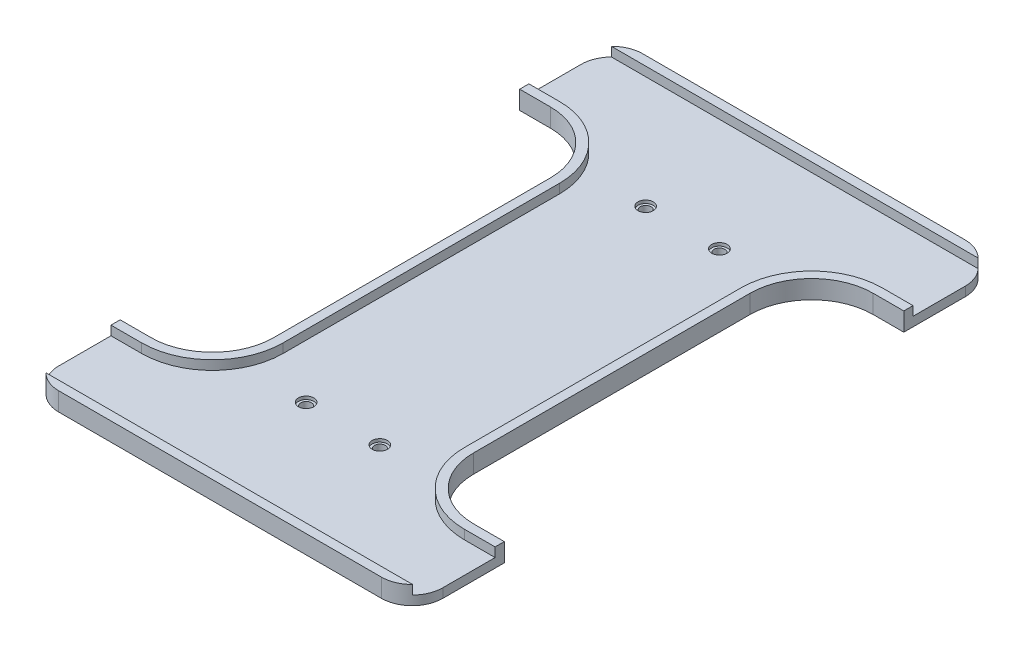
from build123d import *

# Parameters (mm, degrees)
SKETCH1_W           = 125
SKETCH1_H           = 190
SKETCH1_R           = 2.5
SKETCH1_R_2         = 1.75
BOSS_EXTRUDE1_DEPTH = 3
CUT_EXTRUDE1_START  = 2
SKETCH1_3_R         = 2.5
SKETCH1_3_R_2       = 1.75
CUT_EXTRUDE1_DEPTH  = 1
SKETCH2_W           = 30
SKETCH2_H           = 130
CUT_EXTRUDE2_DEPTH  = 114.75521966
FILLET1_R           = 20
FILLET2_R           = 10
BOSS_EXTRUDE2_DEPTH = 3


with BuildPart() as part:
    # Sketch1 → Boss-Extrude1 (new body)
    # profile 1 of 5: a face of its own
    with BuildSketch(Plane(origin=(0, 0, 0), x_dir=(1, 0, 0), z_dir=(0, 1, 0))):
        Rectangle(SKETCH1_W, SKETCH1_H)
        with Locations((-12, 55.5)):
            Circle(SKETCH1_R, mode=Mode.SUBTRACT)
        with Locations((12, 55.5)):
            Circle(SKETCH1_R, mode=Mode.SUBTRACT)
        with Locations((-12, -55)):
            Circle(SKETCH1_R, mode=Mode.SUBTRACT)
        with Locations((12, -55)):
            Circle(SKETCH1_R, mode=Mode.SUBTRACT)
    # profile 2 of 5: a face of its own
    with BuildSketch(Plane(origin=(0, 0, 0), x_dir=(1, 0, 0), z_dir=(0, 1, 0))):
        with Locations((-12, -55)):
            Circle(SKETCH1_R)
        with Locations(Location((-12, -55, 0), (0, 0, 270))):
            Circle(SKETCH1_R_2, mode=Mode.SUBTRACT)
    # profile 3 of 5: a face of its own
    with BuildSketch(Plane(origin=(0, 0, 0), x_dir=(1, 0, 0), z_dir=(0, 1, 0))):
        with Locations((12, -55)):
            Circle(SKETCH1_R)
        with Locations(Location((12, -55, 0), (0, 0, 270))):
            Circle(SKETCH1_R_2, mode=Mode.SUBTRACT)
    # profile 4 of 5: a face of its own
    with BuildSketch(Plane(origin=(0, 0, 0), x_dir=(1, 0, 0), z_dir=(0, 1, 0))):
        with Locations((12, 55.5)):
            Circle(SKETCH1_R)
        with Locations(Location((12, 55.5, 0), (0, 0, 270))):
            Circle(SKETCH1_R_2, mode=Mode.SUBTRACT)
    # profile 5 of 5: a face of its own
    with BuildSketch(Plane(origin=(0, 0, 0), x_dir=(1, 0, 0), z_dir=(0, 1, 0))):
        with Locations((-12, 55.5)):
            Circle(SKETCH1_R)
        with Locations(Location((-12, 55.5, 0), (0, 0, 270))):
            Circle(SKETCH1_R_2, mode=Mode.SUBTRACT)
    extrude(amount=BOSS_EXTRUDE1_DEPTH)

    # Sketch1<3> → Cut-Extrude1 (cut)
    # profile 1 of 4: a face of its own
    with BuildSketch(Plane(origin=(0, 0, 0), x_dir=(1, 0, 0), z_dir=(0, 1, 0)).offset(CUT_EXTRUDE1_START)):
        with Locations(Location((-12, -55, 0), (0, 0, 270))):
            Circle(SKETCH1_3_R)
        with Locations(Location((-12, -55, 0), (0, 0, 270))):
            Circle(SKETCH1_3_R_2, mode=Mode.SUBTRACT)
    # profile 2 of 4: a face of its own
    with BuildSketch(Plane(origin=(0, 0, 0), x_dir=(1, 0, 0), z_dir=(0, 1, 0)).offset(CUT_EXTRUDE1_START)):
        with Locations(Location((12, 55.5, 0), (0, 0, 270))):
            Circle(SKETCH1_3_R)
        with Locations(Location((12, 55.5, 0), (0, 0, 270))):
            Circle(SKETCH1_3_R_2, mode=Mode.SUBTRACT)
    # profile 3 of 4: a face of its own
    with BuildSketch(Plane(origin=(0, 0, 0), x_dir=(1, 0, 0), z_dir=(0, 1, 0)).offset(CUT_EXTRUDE1_START)):
        with Locations(Location((-12, 55.5, 0), (0, 0, 270))):
            Circle(SKETCH1_3_R)
        with Locations(Location((-12, 55.5, 0), (0, 0, 270))):
            Circle(SKETCH1_3_R_2, mode=Mode.SUBTRACT)
    # profile 4 of 4: a face of its own
    with BuildSketch(Plane(origin=(0, 0, 0), x_dir=(1, 0, 0), z_dir=(0, 1, 0)).offset(CUT_EXTRUDE1_START)):
        with Locations(Location((12, -55, 0), (0, 0, 270))):
            Circle(SKETCH1_3_R)
        with Locations(Location((12, -55, 0), (0, 0, 270))):
            Circle(SKETCH1_3_R_2, mode=Mode.SUBTRACT)
    extrude(amount=CUT_EXTRUDE1_DEPTH, mode=Mode.SUBTRACT)

    # Sketch2 → Cut-Extrude2 (cut, through all)
    with BuildSketch(Plane(origin=(0, 3, 0), x_dir=(1, 0, 0), z_dir=(0, 1, 0))):
        with Locations((47.5, 0)):
            Rectangle(SKETCH2_W, SKETCH2_H)
        with Locations((-47.5, 0)):
            Rectangle(SKETCH2_W, SKETCH2_H)
    extrude(amount=-CUT_EXTRUDE2_DEPTH, mode=Mode.SUBTRACT)

    # Fillet1
    fillet1_edges = [part.edges().sort_by_distance(p)[0] for p in [
        (32.5, 1.5, 65),
        (32.5, 1.5, -65),
        (-32.5, 1.5, -65),
        (-32.5, 1.5, 65),
    ]]
    fillet(fillet1_edges, radius=FILLET1_R)

    # Fillet2
    fillet2_edges = [part.edges().sort_by_distance(p)[0] for p in [
        (-62.5, 1.5, 95),
        (-62.5, 1.5, -95),
        (62.5, 1.5, -95),
        (62.5, 1.5, 95),
    ]]
    fillet(fillet2_edges, radius=FILLET2_R)

    # Sketch3 → Boss-Extrude2 (add)
    with BuildSketch(Plane(origin=(0, 3, 0), x_dir=(1, 0, 0), z_dir=(0, 1, 0))):
        with BuildLine():
            Line((-59.5, 68), (-62.5, 68))
            Line((-62.5, 68), (-62.5, 65))
            Line((-62.5, 65), (-52.5, 65))
            ThreePointArc((-52.5, 65), (-38.357864376, 59.142135624), (-32.5, 45))
            Line((-32.5, 45), (-32.5, -45))
            ThreePointArc((-32.5, -45), (-38.357864376, -59.142135624), (-52.5, -65))
            Line((-52.5, -65), (-62.5, -65))
            Line((-62.5, -65), (-62.5, -68))
            Line((-62.5, -68), (-59.5, -68))
            Line((-59.5, -68), (-52.5, -68))
            ThreePointArc((-52.5, -68), (-36.236544033, -61.263455967), (-29.5, -45))
            Line((-29.5, -45), (-29.5, 45))
            ThreePointArc((-29.5, 45), (-36.236544033, 61.263455967), (-52.5, 68))
            Line((-52.5, 68), (-59.5, 68))
        make_face()
        with BuildLine():
            Line((59.5, 68), (62.5, 68))
            Line((62.5, 68), (62.5, 65))
            Line((62.5, 65), (52.5, 65))
            ThreePointArc((52.5, 65), (38.357864376, 59.142135624), (32.5, 45))
            Line((32.5, 45), (32.5, -45))
            ThreePointArc((32.5, -45), (38.357864376, -59.142135624), (52.5, -65))
            Line((52.5, -65), (62.5, -65))
            Line((62.5, -65), (62.5, -68))
            Line((62.5, -68), (59.5, -68))
            Line((59.5, -68), (52.5, -68))
            ThreePointArc((52.5, -68), (36.236544033, -61.263455967), (29.5, -45))
            Line((29.5, -45), (29.5, 45))
            ThreePointArc((29.5, 45), (36.236544033, 61.263455967), (52.5, 68))
            Line((52.5, 68), (59.5, 68))
        make_face()
        with BuildLine():
            Line((-52.5, -92), (-59.641428429, -92))
            ThreePointArc((-59.641428429, -92), (-56.372983346, -94.219544457), (-52.5, -95))
            Line((-52.5, -95), (52.5, -95))
            ThreePointArc((52.5, -95), (56.372983346, -94.219544457), (59.641428429, -92))
            Line((59.641428429, -92), (52.5, -92))
            Line((52.5, -92), (-52.5, -92))
        make_face()
        with BuildLine():
            Line((-52.5, 92), (-59.641428429, 92))
            ThreePointArc((-59.641428429, 92), (-56.372983346, 94.219544457), (-52.5, 95))
            Line((-52.5, 95), (52.5, 95))
            ThreePointArc((52.5, 95), (56.372983346, 94.219544457), (59.641428429, 92))
            Line((59.641428429, 92), (52.5, 92))
            Line((52.5, 92), (-52.5, 92))
        make_face()
    extrude(amount=BOSS_EXTRUDE2_DEPTH)


solid = part.part
